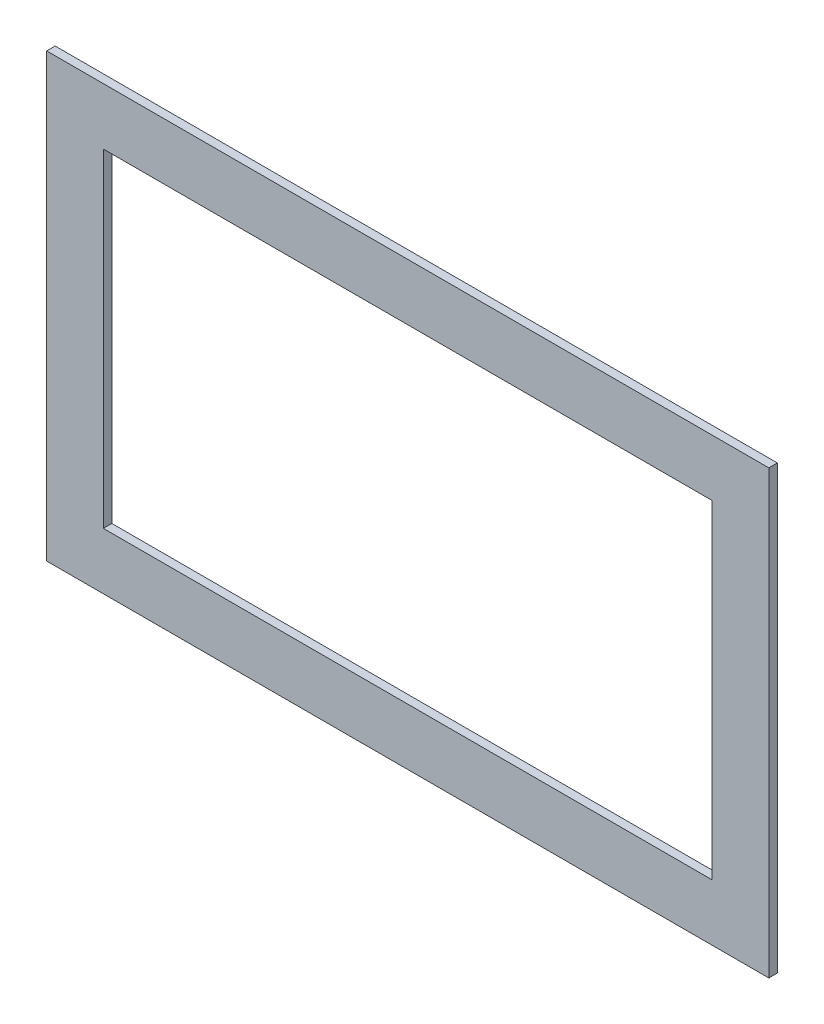
from build123d import *

# Parameters (mm, degrees)
SKETCH2_W           = 255
SKETCH2_H           = 156
SKETCH2_W_2         = 215
SKETCH2_H_2         = 116
BOSS_EXTRUDE1_DEPTH = 3


with BuildPart() as part:
    # Sketch2 → Boss-Extrude1 (new body)
    with BuildSketch(Plane(origin=(0, 0, 24.28985078), x_dir=(-1, 0, 0), z_dir=(0, 0, -1))):
        with Locations((117.71753429, 78.585651873)):
            Rectangle(SKETCH2_W, SKETCH2_H)
        with Locations((117.71753429, 78.585651873)):
            Rectangle(SKETCH2_W_2, SKETCH2_H_2, mode=Mode.SUBTRACT)
    extrude(amount=BOSS_EXTRUDE1_DEPTH)


solid = part.part
